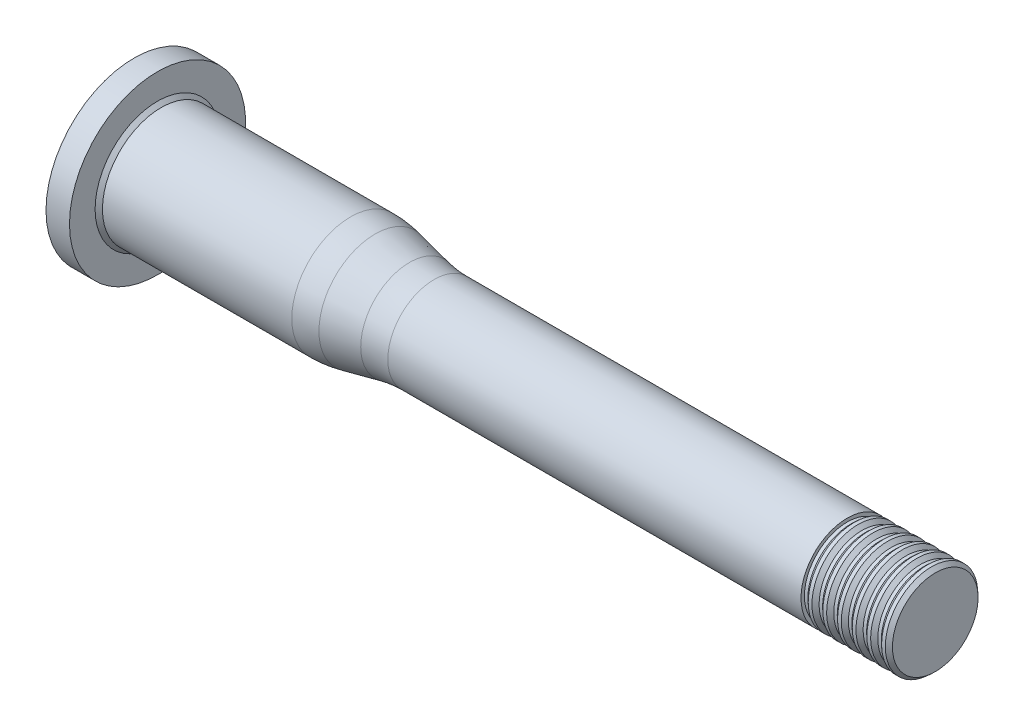
from build123d import *

# Parameters (mm, degrees)
LPATTERN1_COUNT    = 6
LPATTERN1_PITCH    = 3.175
CUT_EXTRUDE1_DEPTH = 6.35
FILLET1_R          = 25.4
CHAMFER1_SIZE      = 0.79375


with BuildPart() as part:
    # Sketch2 → Revolve1 (revolve)
    with BuildSketch(Plane.XY):
        Polygon((-5.08, 0), (168.275, 0), (168.275, 10), (57.15, 10), (44.45, 12.7127), (0, 12.7127), (0, 19.05), (-5.08, 19.05), align=None)
    revolve(axis=Axis((-8.585810146, 0, 0), (1, 0, 0)))

    # Sketch3 → Cut-Revolve1 (revolve, cut)
    with BuildSketch(Plane.XY):
        Polygon((168.275, 9.2634), (167.438897849, 10.0254), (166.6875, 10.0254), (165.851397849, 9.2634), (165.1, 9.2634), (165.1, 10.5334), (168.275, 10.5334), align=None)
    cut_revolve1 = revolve(axis=Axis((-8.585810146, 0, 0), (1, 0, 0)), mode=Mode.SUBTRACT)

    # LPattern1: Cut-Revolve1 ×6
    with Locations(*[(-i * LPATTERN1_PITCH, 0, 0) for i in range(1, LPATTERN1_COUNT)]):
        add(cut_revolve1, mode=Mode.SUBTRACT)

    # Sketch4 → Cut-Extrude1 (cut)
    with BuildSketch(Plane.ZY.offset(5.08)):
        Polygon((0, 10.998522628), (-9.525, 5.499261314), (-9.525, -5.499261314), (0, -10.998522628), (9.525, -5.499261314), (9.525, 5.499261314), align=None)
    extrude(amount=-CUT_EXTRUDE1_DEPTH, mode=Mode.SUBTRACT)

    # Fillet1
    fillet1_edges = [part.edges().sort_by_distance(p)[0] for p in [
        (57.15, -10, 0),
        (44.45, -12.7127, 0),
    ]]
    fillet(fillet1_edges, radius=FILLET1_R)

    # Chamfer1
    chamfer1_edges = [part.edges().sort_by_distance(p)[0] for p in [
        (0, -12.7127, 0),
    ]]
    chamfer(chamfer1_edges, length=CHAMFER1_SIZE)


solid = part.part
